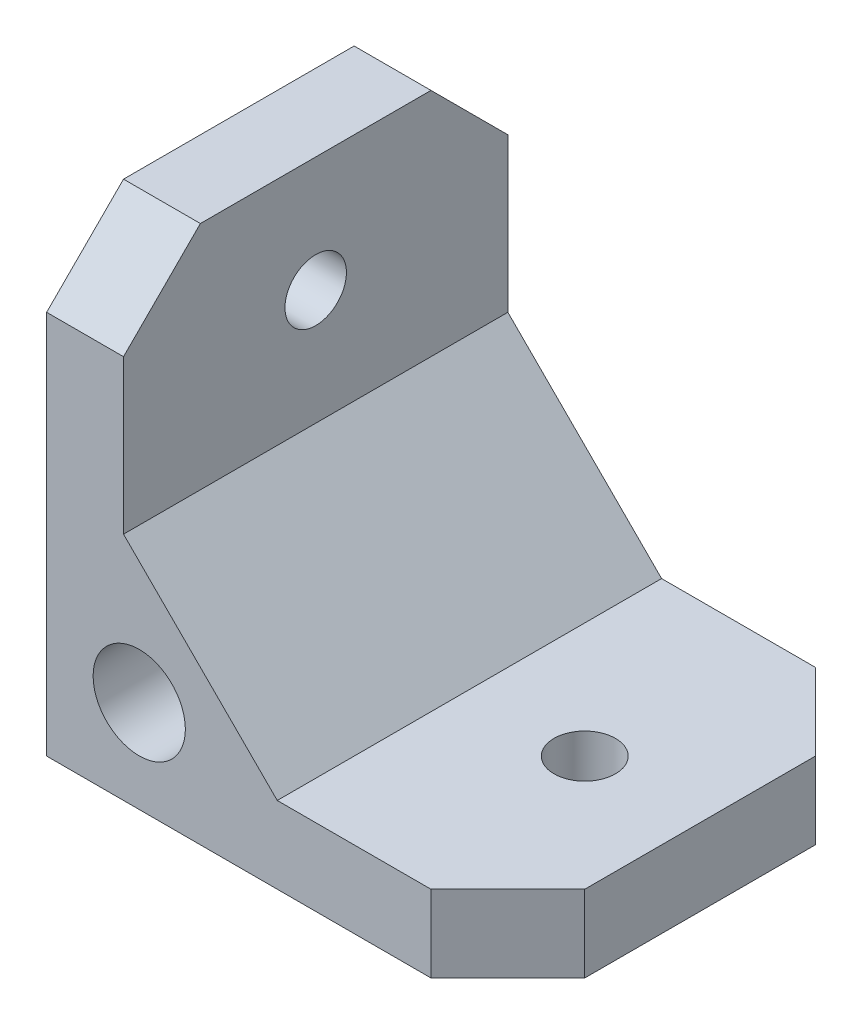
from build123d import *

# Parameters (mm, degrees)
SKETCH1_W               = 24
SKETCH1_H               = 20
BOSS_EXTRUDE1_DEPTH     = 4
SKETCH2_W               = 4
SKETCH2_H               = 20
BOSS_EXTRUDE2_DEPTH     = 20
CHAMFER1_SIZE           = 8
SKETCH3_R               = 1.6
CUT_EXTRUDE1_DEPTH      = 20
SKETCH4_R               = 1.6
CUT_EXTRUDE2_DEPTH      = 20
CHAMFER2_SIZE           = 4
CUT_EXTRUDE3_DEPTH      = 40.395431207
CUT_EXTRUDE3_DEPTH_BACK = 40.395431207
SKETCH5_R               = 2.4


with BuildPart() as part:
    # Sketch1 → Boss-Extrude1 (new body)
    with BuildSketch(Plane(origin=(0, 0, 0), x_dir=(1, 0, 0), z_dir=(0, 1, 0))):
        with Locations((12, 10)):
            Rectangle(SKETCH1_W, SKETCH1_H)
    extrude(amount=BOSS_EXTRUDE1_DEPTH)

    # Sketch2 → Boss-Extrude2 (add)
    with BuildSketch(Plane(origin=(0, 4, 0), x_dir=(1, 0, 0), z_dir=(0, 1, 0))):
        with Locations((2, 10)):
            Rectangle(SKETCH2_W, SKETCH2_H)
    extrude(amount=BOSS_EXTRUDE2_DEPTH)

    # Chamfer1
    chamfer1_edges = [part.edges().sort_by_distance(p)[0] for p in [
        (4, 4, -10),
    ]]
    chamfer(chamfer1_edges, length=CHAMFER1_SIZE)

    # Sketch3 → Cut-Extrude1 (cut)
    with BuildSketch(Plane(origin=(0, 4, 0), x_dir=(1, 0, 0), z_dir=(0, 1, 0))):
        with Locations(Location((18, 10, 0), (0, 0, 270))):
            Circle(SKETCH3_R)
    extrude(amount=-CUT_EXTRUDE1_DEPTH, mode=Mode.SUBTRACT)

    # Sketch4 → Cut-Extrude2 (cut)
    with BuildSketch(Plane(origin=(4, 0, 0), x_dir=(0, 0, -1), z_dir=(1, 0, 0))):
        with Locations((10, 18)):
            Circle(SKETCH4_R)
    extrude(amount=-CUT_EXTRUDE2_DEPTH, mode=Mode.SUBTRACT)

    # Chamfer2
    chamfer2_edges = [part.edges().sort_by_distance(p)[0] for p in [
        (2, 24, 0),
        (2, 24, -20),
        (24, 2, -20),
        (24, 2, 0),
    ]]
    chamfer(chamfer2_edges, length=CHAMFER2_SIZE)

    # Sketch5 → Cut-Extrude3 (cut, two sides: drawn at the far end of the back side and taken through both)
    with BuildSketch(Plane.XY.offset(-CUT_EXTRUDE3_DEPTH_BACK)):
        with Locations((4.818019485, 4.818019485)):
            Circle(SKETCH5_R)
    extrude(amount=CUT_EXTRUDE3_DEPTH + CUT_EXTRUDE3_DEPTH_BACK, mode=Mode.SUBTRACT)


solid = part.part
